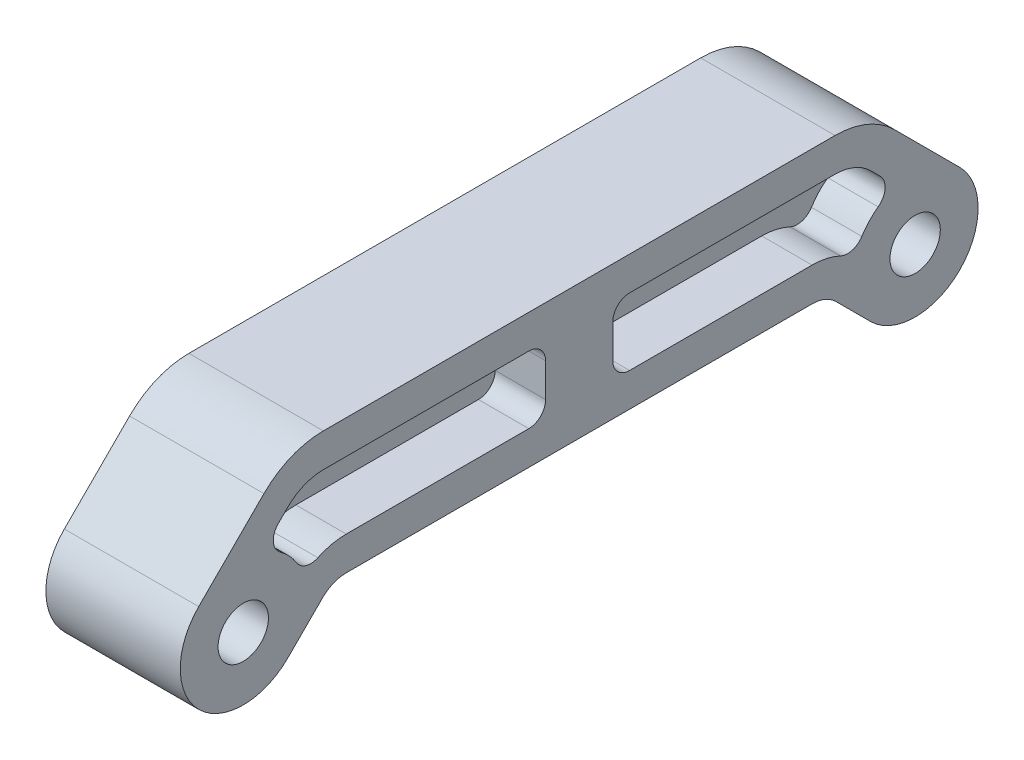
from build123d import *

# Parameters (mm, degrees)
SKETCH_1_R          = 1.5
EXTRUDE_1_DEPTH     = 4
FILLET_1_R          = 2
FILLET_2_R          = 5
CUT_EXTRUDE_1_DEPTH = 3
FILLET_3_R          = 1


with BuildPart() as part:
    # 草图1 → 凸台-拉伸1 (new, symmetric)
    with BuildSketch(Plane(origin=(0, 0, 0), x_dir=(0, 0, -1), z_dir=(1, 0, 0))):
        with BuildLine():
            Line((2.651650429, -2.651650429), (5.303300859, 0))
            Line((5.303300859, 0), (34.696699141, 0))
            Line((34.696699141, 0), (37.348349571, -2.651650429))
            ThreePointArc((37.348349571, -2.651650429), (42.651650429, -2.651650429), (42.651650429, 2.651650429))
            Line((42.651650429, 2.651650429), (37.303300859, 8))
            Line((37.303300859, 8), (2.696699141, 8))
            Line((2.696699141, 8), (-2.651650429, 2.651650429))
            ThreePointArc((-2.651650429, 2.651650429), (-2.651650429, -2.651650429), (2.651650429, -2.651650429))
        make_face()
        Circle(SKETCH_1_R, mode=Mode.SUBTRACT)
        with Locations((40, 0)):
            Circle(SKETCH_1_R, mode=Mode.SUBTRACT)
    extrude(amount=EXTRUDE_1_DEPTH, both=True)

    # 圆角1
    fillet_1_edges = [part.edges().sort_by_distance(p)[0] for p in [
        (0, 0, -34.696699141),
        (0, 0, -5.303300859),
    ]]
    fillet(fillet_1_edges, radius=FILLET_1_R)

    # 圆角2
    fillet_2_edges = [part.edges().sort_by_distance(p)[0] for p in [
        (0, 8, -2.696699141),
        (0, 8, -37.303300859),
    ]]
    fillet(fillet_2_edges, radius=FILLET_2_R)

    # 草图2 → 切除-拉伸1 (cut)
    with BuildSketch(Plane(origin=(4, 0, 0), x_dir=(0, 0, -1), z_dir=(1, 0, 0))):
        with BuildLine():
            Line((18, 6), (18, 2))
            Line((18, 2), (6.131727984, 2))
            ThreePointArc((6.131727984, 2), (4.780909332, 1.765008496), (3.588806135, 1.087644486))
            ThreePointArc((3.588806135, 1.087644486), (2.659081759, 2.644198215), (1.107771013, 3.582644747))
            Line((1.107771013, 3.582644747), (2.646446609, 5.121320344))
            ThreePointArc((2.646446609, 5.121320344), (3.619716656, 5.771638598), (4.767766953, 6))
            Line((4.767766953, 6), (18, 6))
        make_face()
        with BuildLine():
            Line((22, 2), (22, 6))
            Line((22, 6), (35.232233047, 6))
            ThreePointArc((35.232233047, 6), (36.380283344, 5.771638598), (37.353553391, 5.121320344))
            Line((37.353553391, 5.121320344), (38.892228987, 3.582644747))
            ThreePointArc((38.892228987, 3.582644747), (37.340918241, 2.644198215), (36.411193865, 1.087644486))
            ThreePointArc((36.411193865, 1.087644486), (35.219090668, 1.765008496), (33.868272016, 2))
            Line((33.868272016, 2), (22, 2))
        make_face()
    cut_extrude_1 = extrude(amount=-CUT_EXTRUDE_1_DEPTH, mode=Mode.SUBTRACT)

    # 镜向1: 切除-拉伸1 across plane
    add(cut_extrude_1.mirror(Plane(origin=(0, 0, 0), x_dir=(0, 0, 1), z_dir=(1, 0, 0))), mode=Mode.SUBTRACT)

    # 圆角3
    fillet_3_edges = [part.edges().sort_by_distance(p)[0] for p in [
        (-2.5, 1.087644486, -36.411193865),
        (-2.5, 3.582644747, -38.892228987),
        (-2.5, 6, -22),
        (-2.5, 2, -22),
        (-2.5, 6, -18),
        (-2.5, 3.582644747, -1.107771013),
        (-2.5, 1.087644486, -3.588806135),
        (-2.5, 2, -18),
        (2.5, 1.087644486, -36.411193865),
        (2.5, 2, -22),
        (2.5, 6, -22),
        (2.5, 3.582644747, -38.892228987),
        (2.5, 6, -18),
        (2.5, 2, -18),
        (2.5, 1.087644486, -3.588806135),
        (2.5, 3.582644747, -1.107771013),
    ]]
    fillet(fillet_3_edges, radius=FILLET_3_R)


solid = part.part
